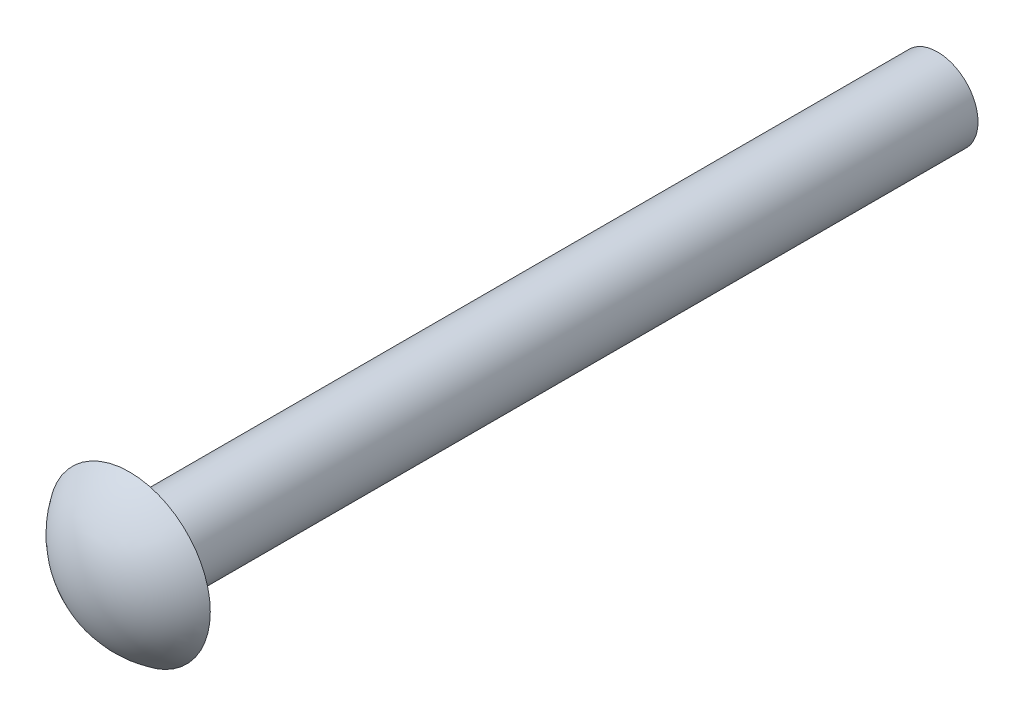
from build123d import *

# Parameters (mm, degrees)
SKETCH2_R           = 0.635
BOSS_EXTRUDE1_DEPTH = 12.7


with BuildPart() as part:
    # Sketch1 → Revolve1 (revolve)
    with BuildSketch(Plane(origin=(0, 0, 0), x_dir=(0, 0, -1), z_dir=(1, 0, 0))):
        with BuildLine():
            Line((0, 0), (0, 1.27))
            ThreePointArc((0, 1.27), (-0.500415378, 0.72066768), (-0.681577303, 0))
            Line((-0.681577303, 0), (0, 0))
        make_face()
    revolve(axis=Axis((0, 0, 0.681577303), (0, 0, -1)))

    # Sketch2 → Boss-Extrude1 (add)
    with BuildSketch(Plane(origin=(0, 0, 0), x_dir=(-1, 0, 0), z_dir=(0, 0, -1))):
        with Locations(Location((0, 0, 0), (0, 0, 180))):
            Circle(SKETCH2_R)
    extrude(amount=BOSS_EXTRUDE1_DEPTH)


solid = part.part
